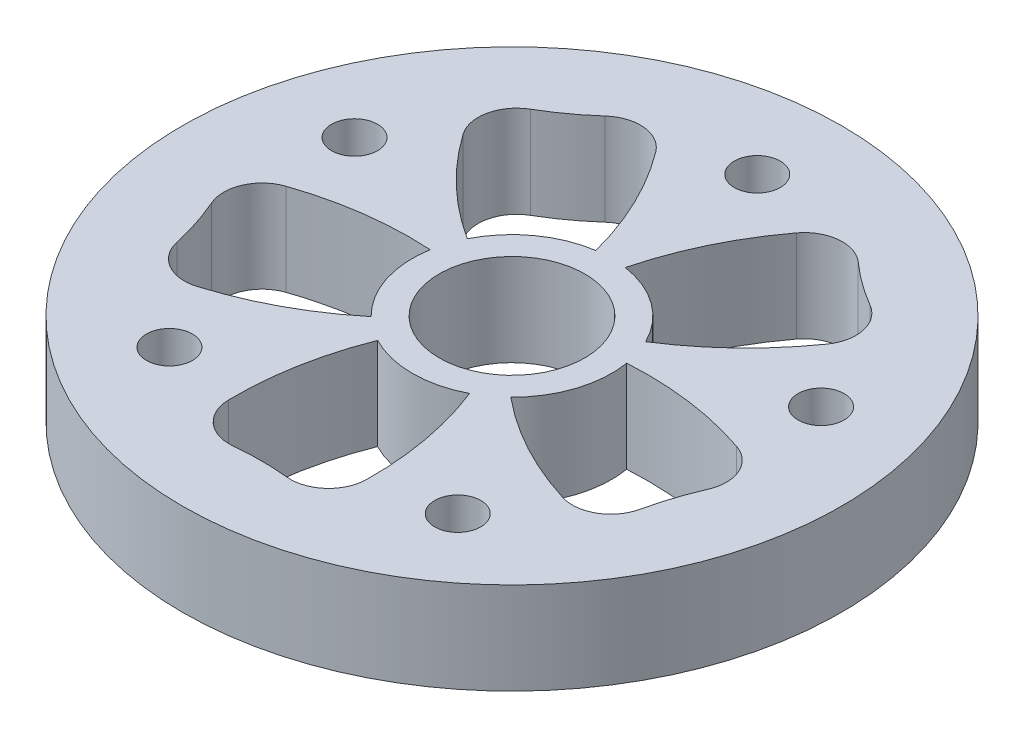
from build123d import *

# Parameters (mm, degrees)
SKETCH_1_R               = 43
SKETCH_1_R_2             = 9.5
SKETCH_1_R_3             = 3
EXTRUDE_1_DEPTH          = 12
CUT_EXTRUDE_1_DEPTH      = 62.983868869
CUT_EXTRUDE_1_DEPTH_BACK = 62.983868869


with BuildPart() as part:
    # 草图1 → 凸台-拉伸1 (new body)
    with BuildSketch(Plane(origin=(0, 0, 0), x_dir=(1, 0, 0), z_dir=(0, 1, 0))):
        with Locations(Location((0, 0, 0), (0, 0, 270))):
            Circle(SKETCH_1_R)
        with Locations(Location((0, 0, 0), (0, 0, 270))):
            Circle(SKETCH_1_R_2, mode=Mode.SUBTRACT)
        with Locations(Location((0, 32, 0), (0, 0, 270))):
            Circle(SKETCH_1_R_3, mode=Mode.SUBTRACT)
        with Locations(Location((30.433808521, 9.88854382, 0), (0, 0, 270))):
            Circle(SKETCH_1_R_3, mode=Mode.SUBTRACT)
        with Locations(Location((18.809128073, -25.88854382, 0), (0, 0, 270))):
            Circle(SKETCH_1_R_3, mode=Mode.SUBTRACT)
        with Locations(Location((-18.809128073, -25.88854382, 0), (0, 0, 270))):
            Circle(SKETCH_1_R_3, mode=Mode.SUBTRACT)
        with Locations(Location((-30.433808521, 9.88854382, 0), (0, 0, 270))):
            Circle(SKETCH_1_R_3, mode=Mode.SUBTRACT)
    extrude(amount=EXTRUDE_1_DEPTH)

    # 草图2 → 切除-拉伸1 (cut, two sides: drawn at the far end of the back side and taken through both)
    with BuildSketch(Plane(origin=(0, 0, 0), x_dir=(1, 0, 0), z_dir=(0, 1, 0)).offset(-CUT_EXTRUDE_1_DEPTH_BACK)):
        with BuildLine():
            ThreePointArc((-23.848620344, -17.211397152), (-16.091180112, -13.964625454), (-9.114016839, -9.270096928))
            ThreePointArc((-9.114016839, -9.270096928), (-12.363734712, -4.017220927), (-12.822220771, 2.142581267))
            ThreePointArc((-12.822220771, 2.142581267), (-21.226239066, 1.839460951), (-29.410544568, -0.093554533))
            ThreePointArc((-29.410544568, -0.093554533), (-32.369922784, -2.815813731), (-32.36785177, -6.83683478))
            ThreePointArc((-32.36785177, -6.83683478), (-31.119439219, -10.111318738), (-30.204732809, -13.494230394))
            ThreePointArc((-30.204732809, -13.494230394), (-27.842911423, -16.748522069), (-23.848620344, -17.211397152))
        make_face()
        with BuildLine():
            ThreePointArc((8.999382438, -28), (8.308699922, -19.618928286), (6, -11.532562595))
            ThreePointArc((6, -11.532562595), (0, -13), (-6, -11.532562595))
            ThreePointArc((-6, -11.532562595), (-8.308699922, -19.618928286), (-8.999382438, -28))
            ThreePointArc((-8.999382438, -28), (-7.324858249, -31.655760291), (-3.5, -32.896354479))
            ThreePointArc((-3.5, -32.896354479), (0, -32.720914778), (3.5, -32.896354479))
            ThreePointArc((3.5, -32.896354479), (7.324858249, -31.655760291), (8.999382438, -28))
        make_face()
        with BuildLine():
            ThreePointArc((12.822220771, 2.142581267), (12.955478957, 1.074972086), (13, 0))
            ThreePointArc((13, 0), (11.989208041, -5.025822375), (9.114016839, -9.270096928))
            ThreePointArc((9.114016839, -9.270096928), (16.091180112, -13.964625454), (23.848620344, -17.211397152))
            ThreePointArc((23.848620344, -17.211397152), (27.842911423, -16.748522069), (30.204732809, -13.494230394))
            ThreePointArc((30.204732809, -13.494230394), (31.119439219, -10.111318738), (32.36785177, -6.83683478))
            ThreePointArc((32.36785177, -6.83683478), (32.369922784, -2.815813731), (29.410544568, -0.093554533))
            ThreePointArc((29.410544568, -0.093554533), (21.226239066, 1.839460951), (12.822220771, 2.142581267))
        make_face()
        with BuildLine():
            ThreePointArc((1.924568248, 12.856750642), (7.64120828, 10.517220927), (11.632772181, 5.803327614))
            ThreePointArc((11.632772181, 5.803327614), (18.25359615, 10.988315115), (23.738640395, 17.362771566))
            ThreePointArc((23.738640395, 17.362771566), (24.532723854, 21.304604391), (22.167551497, 24.556461444))
            ThreePointArc((22.167551497, 24.556461444), (19.232871148, 26.471776127), (16.504432537, 28.67095821))
            ThreePointArc((16.504432537, 28.67095821), (12.680854244, 29.915491699), (9.177333733, 27.942180119))
            ThreePointArc((9.177333733, 27.942180119), (4.809837274, 20.755777674), (1.924568248, 12.856750642))
        make_face()
        with BuildLine():
            ThreePointArc((-11.632772181, 5.803327614), (-7.64120828, 10.517220927), (-1.924568248, 12.856750642))
            ThreePointArc((-1.924568248, 12.856750642), (-4.809837274, 20.755777674), (-9.177333733, 27.942180119))
            ThreePointArc((-9.177333733, 27.942180119), (-12.680854244, 29.915491699), (-16.504432537, 28.67095821))
            ThreePointArc((-16.504432537, 28.67095821), (-19.232871148, 26.471776127), (-22.167551497, 24.556461444))
            ThreePointArc((-22.167551497, 24.556461444), (-24.532723854, 21.304604391), (-23.738640395, 17.362771566))
            ThreePointArc((-23.738640395, 17.362771566), (-18.25359615, 10.988315115), (-11.632772181, 5.803327614))
        make_face()
    extrude(amount=CUT_EXTRUDE_1_DEPTH + CUT_EXTRUDE_1_DEPTH_BACK, mode=Mode.SUBTRACT)


solid = part.part
